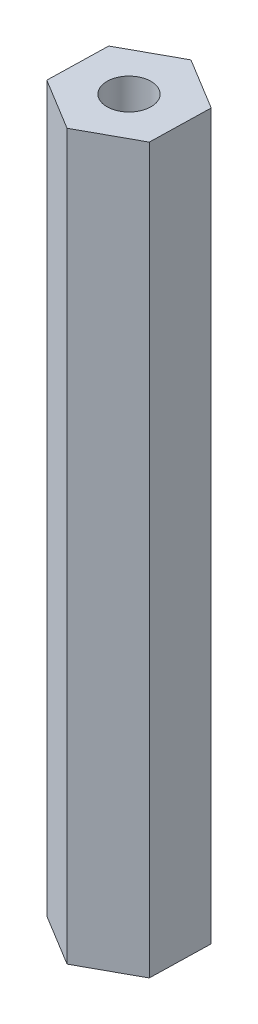
from build123d import *

# Parameters (mm, degrees)
BOSS_EXTRUDE1_DEPTH = 34.5
CUT_EXTRUDE1_START  = 41.5
SKETCH1_3_R         = 2.1
CUT_EXTRUDE1_DEPTH  = 77.844321237


with BuildPart() as part:
    # Sketch1 → Boss-Extrude1 (new, symmetric)
    with BuildSketch(Plane(origin=(0, 0, 0), x_dir=(1, 0, 0), z_dir=(0, 1, 0))):
        Polygon((5.065112622, 2.770914552), (0.132873917, 5.77197348), (-4.932238705, 3.001058928), (-5.065112622, -2.770914552), (-0.132873917, -5.77197348), (4.932238705, -3.001058928), align=None)
    extrude(amount=BOSS_EXTRUDE1_DEPTH, both=True)

    # Sketch1<3> → Cut-Extrude1 (cut, through all)
    with BuildSketch(Plane(origin=(0, 0, 0), x_dir=(1, 0, 0), z_dir=(0, 1, 0)).offset(CUT_EXTRUDE1_START)):
        Circle(SKETCH1_3_R)
    extrude(amount=-CUT_EXTRUDE1_DEPTH, mode=Mode.SUBTRACT)


solid = part.part
